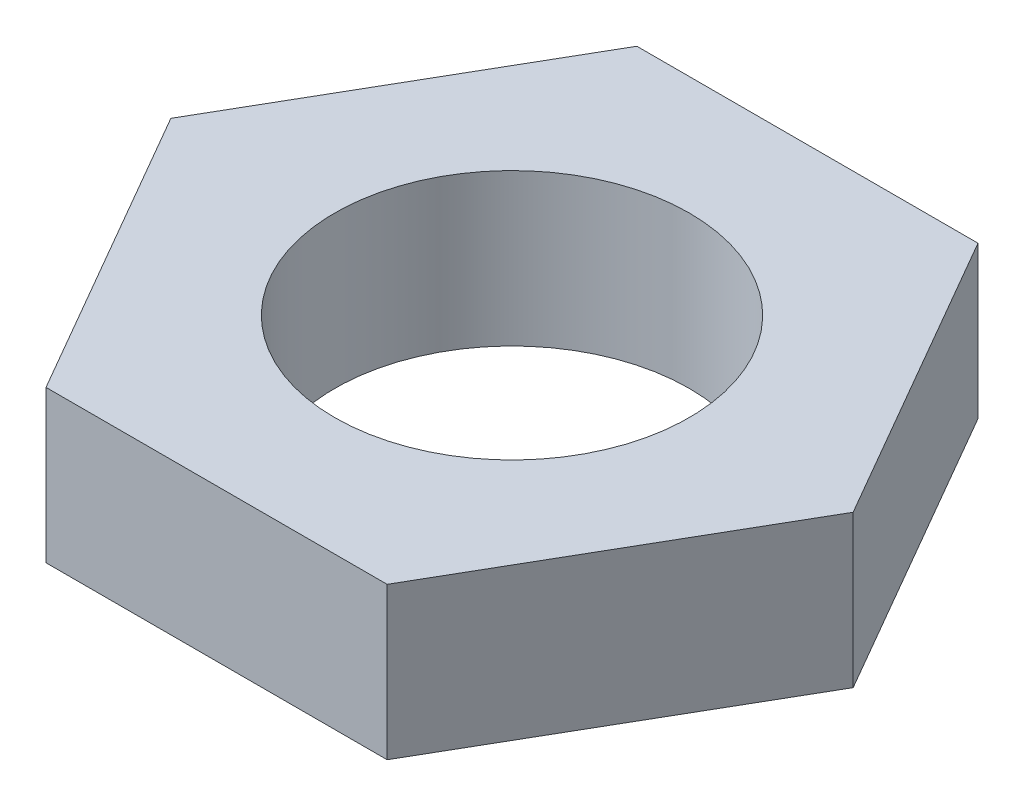
from build123d import *

# Parameters (mm, degrees)
SKETCH1_R           = 2.1
BOSS_EXTRUDE1_DEPTH = 1.8


with BuildPart() as part:
    # Sketch1 → Boss-Extrude1 (new body)
    with BuildSketch(Plane(origin=(0, 0, 0), x_dir=(1, 0, 0), z_dir=(0, 1, 0))):
        Polygon((4.041451884, 0), (2.020725942, 3.5), (-2.020725942, 3.5), (-4.041451884, 0), (-2.020725942, -3.5), (2.020725942, -3.5), align=None)
        with Locations(Location((0, 0, 0), (0, 0, 270))):
            Circle(SKETCH1_R, mode=Mode.SUBTRACT)
    extrude(amount=BOSS_EXTRUDE1_DEPTH)


solid = part.part
